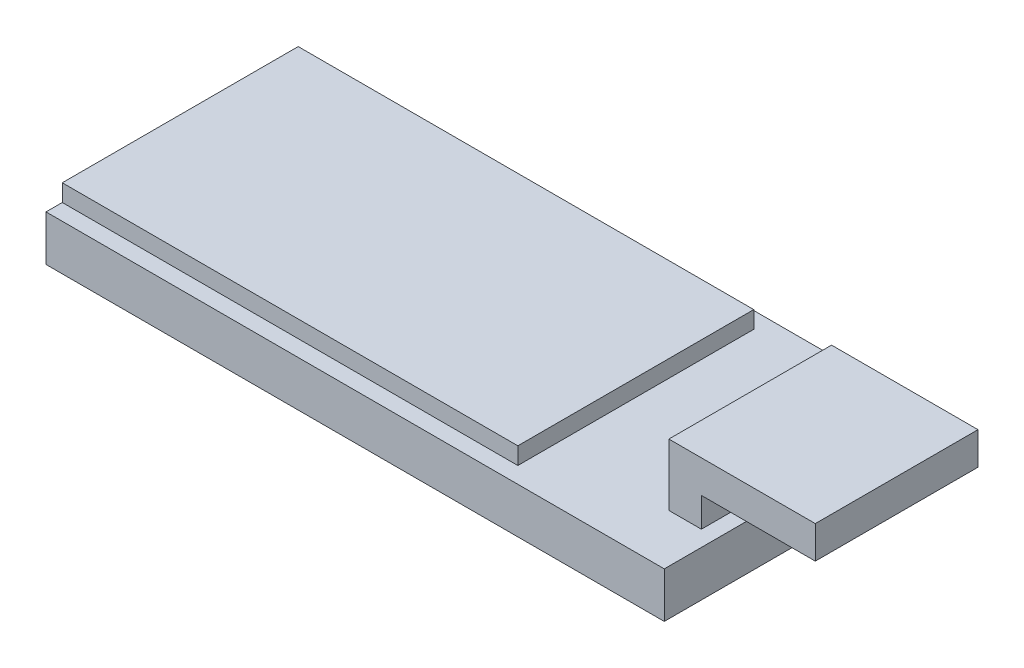
from build123d import *

# Parameters (mm, degrees)
BOSS_EXTRUDE1_DEPTH      = 2.4
BOSS_EXTRUDE1_DEPTH_BACK = 0.4
SKETCH1_W                = 28
SKETCH1_H                = 14.5
BOSS_EXTRUDE2_START      = 2.4
SKETCH1_3_W              = 28
SKETCH1_3_H              = 14.5
BOSS_EXTRUDE2_DEPTH      = 1.05
BOSS_EXTRUDE3_DEPTH      = 5


with BuildPart() as part:
    # Sketch1 → Boss-Extrude1 (new, two sides: drawn at the far end of the back side and taken through both)
    with BuildSketch(Plane(origin=(0, 0, 0), x_dir=(1, 0, 0), z_dir=(0, 1, 0)).offset(-BOSS_EXTRUDE1_DEPTH_BACK)):
        Polygon((38, 8.25), (0, 8.25), (0, 7.25), (28, 7.25), (28, -7.25), (0, -7.25), (0, -8.25), (38, -8.25), align=None)
        with Locations((14, 0)):
            Rectangle(SKETCH1_W, SKETCH1_H)
    extrude(amount=BOSS_EXTRUDE1_DEPTH + BOSS_EXTRUDE1_DEPTH_BACK)

    # Sketch1<3> → Boss-Extrude2 (add)
    with BuildSketch(Plane(origin=(0, 0, 0), x_dir=(1, 0, 0), z_dir=(0, 1, 0)).offset(BOSS_EXTRUDE2_START)):
        with Locations((14, 0)):
            Rectangle(SKETCH1_3_W, SKETCH1_3_H)
    extrude(amount=BOSS_EXTRUDE2_DEPTH)

    # Sketch2 → Boss-Extrude3 (add, symmetric)
    with BuildSketch(Plane.XY):
        Polygon((37.032081111, -1), (35.032081111, -1), (35.032081111, 6.2), (44.032081111, 6.2), (44.032081111, 4.2), (37.032081111, 4.2), align=None)
    extrude(amount=BOSS_EXTRUDE3_DEPTH, both=True)


solid = part.part
